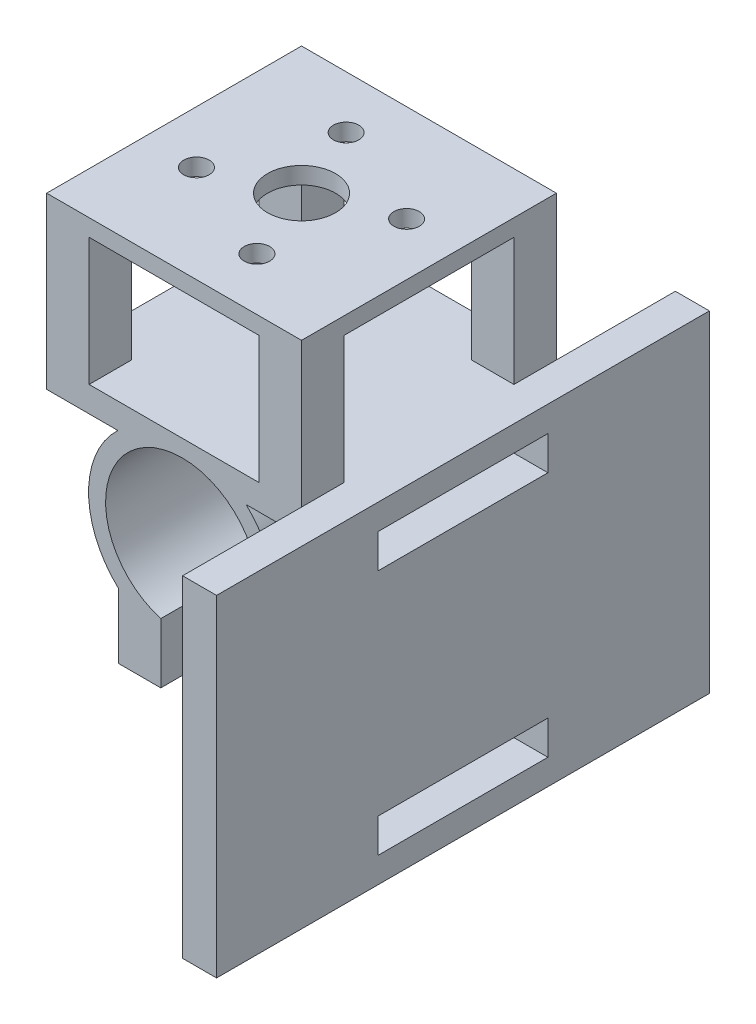
from build123d import *

# Parameters (mm, degrees)
SUPPORTOMOTORE_DEPTH     = 30
SCHIZZO2_W               = 58
SCHIZZO2_H               = 39
SUPPORTOESC_DEPTH        = 4
COLONNESUPPORTOESC_REACH = 62.166
SCHIZZO3_R               = 3
SCHIZZO7_W               = 5
SCHIZZO7_H               = 5
SUPPORTIBASEMOTORE_DEPTH = 15
SCHIZZO8_W               = 30
SCHIZZO8_H               = 30
BASEMOTORE_DEPTH         = 2
SCHIZZO9_R               = 1.5
SCHIZZO9_R_2             = 4
FORIAGGANCIOMOTORE_DEPTH = 2
SCHIZZO10_W              = 20
SCHIZZO10_H              = 4
APERTURAFASCETTA_DEPTH   = 4


with BuildPart() as part:
    # Schizzo1 → SupportoMotore (new body)
    with BuildSketch(Plane.XY):
        with BuildLine():
            Line((-2.5, -10.712142643), (-2.5, -15.712142643))
            Line((-2.5, -15.712142643), (-7.5, -15.712142643))
            Line((-7.5, -15.712142643), (-7.5, -8.04673847))
            ThreePointArc((-7.5, -8.04673847), (-10.999946955, -0.034161219), (-7.549834435, 8))
            Line((-7.549834435, 8), (-15.935446939, 8))
            Line((-15.935446939, 8), (-15.935446939, 11))
            Line((-15.935446939, 11), (14.064553061, 11))
            Line((14.064553061, 11), (14.064553061, 8))
            Line((14.064553061, 8), (7.549834435, 8))
            ThreePointArc((7.549834435, 8), (10.999946955, -0.034161219), (7.5, -8.04673847))
            Line((7.5, -8.04673847), (7.5, -15.712142643))
            Line((7.5, -15.712142643), (2.5, -15.712142643))
            Line((2.5, -15.712142643), (2.5, -10.712142643))
            Line((2.5, -10.712142643), (2.5, -8.645808233))
            ThreePointArc((2.5, -8.645808233), (0, 9), (-2.5, -8.645808233))
            Line((-2.5, -8.645808233), (-2.5, -10.712142643))
        make_face()
    extrude(amount=SUPPORTOMOTORE_DEPTH)

    # Schizzo2 → SupportoESC (add)
    with BuildSketch(Plane(origin=(14.064553061, 0, 0), x_dir=(0, 0, -1), z_dir=(1, 0, 0))):
        with Locations((-15, -8.5)):
            Rectangle(SCHIZZO2_W, SCHIZZO2_H)
    extrude(amount=SUPPORTOESC_DEPTH)

    # Schizzo3 → ColonneSupportoESC (add, up to next)
    with BuildSketch(Plane.ZY.offset(-14.064553061), mode=Mode.PRIVATE) as colonnesupportoesc_sk1:
        with Locations(Location((22, -6, 0), (0, 0, 223.019415965))):
            Circle(SCHIZZO3_R)
    colonnesupportoesc_tool1 = extrude(colonnesupportoesc_sk1.sketch, amount=COLONNESUPPORTOESC_REACH, mode=Mode.PRIVATE) - part.part
    # Schizzo3 → ColonneSupportoESC (add, up to next)
    with BuildSketch(Plane.ZY.offset(-14.064553061), mode=Mode.PRIVATE) as colonnesupportoesc_sk2:
        with Locations(Location((8, -6, 0), (0, 0, 223.019415965))):
            Circle(SCHIZZO3_R)
    colonnesupportoesc_tool2 = extrude(colonnesupportoesc_sk2.sketch, amount=COLONNESUPPORTOESC_REACH, mode=Mode.PRIVATE) - part.part
    add(colonnesupportoesc_tool1.solids().sort_by_distance((14.064553, -6, 22))[0])
    add(colonnesupportoesc_tool2.solids().sort_by_distance((14.064553, -6, 8))[0])

    # Schizzo7 → SupportiBaseMotore (add)
    with BuildSketch(Plane(origin=(0, 11, 0), x_dir=(1, 0, 0), z_dir=(0, 1, 0))):
        with Locations((-13.435446939, -27.5)):
            Rectangle(SCHIZZO7_W, SCHIZZO7_H)
        with Locations((11.564553061, -27.5)):
            Rectangle(SCHIZZO7_W, SCHIZZO7_H)
        with Locations((11.564553061, -2.5)):
            Rectangle(SCHIZZO7_W, SCHIZZO7_H)
        with Locations((-13.435446939, -2.5)):
            Rectangle(SCHIZZO7_W, SCHIZZO7_H)
    extrude(amount=SUPPORTIBASEMOTORE_DEPTH)

    # Schizzo8 → BaseMotore (add)
    with BuildSketch(Plane(origin=(0, 26, 0), x_dir=(1, 0, 0), z_dir=(0, 1, 0))):
        with Locations((-0.935446939, -15)):
            Rectangle(SCHIZZO8_W, SCHIZZO8_H)
    extrude(amount=BASEMOTORE_DEPTH)

    # Schizzo9 → ForiAggancioMotore (cut)
    with BuildSketch(Plane(origin=(0, 28, 0), x_dir=(1, 0, 0), z_dir=(0, 1, 0))):
        with Locations(Location((2.623315698, -23.808246618, 0), (0, 0, 270))):
            Circle(SCHIZZO9_R)
        with Locations(Location((-9.743693557, -18.558762637, 0), (0, 0, 270))):
            Circle(SCHIZZO9_R)
        with Locations(Location((-4.494209576, -6.191753382, 0), (0, 0, 270))):
            Circle(SCHIZZO9_R)
        with Locations(Location((7.872799679, -11.441237363, 0), (0, 0, 270))):
            Circle(SCHIZZO9_R)
        with Locations(Location((-0.935446939, -15, 0), (0, 0, 270))):
            Circle(SCHIZZO9_R_2)
    extrude(amount=-FORIAGGANCIOMOTORE_DEPTH, mode=Mode.SUBTRACT)

    # Schizzo10 → AperturaFascetta (cut)
    with BuildSketch(Plane(origin=(18.064553061, 0, 0), x_dir=(0, 0, -1), z_dir=(1, 0, 0))):
        with Locations((-15, 6)):
            Rectangle(SCHIZZO10_W, SCHIZZO10_H)
        with Locations((-15, -23)):
            Rectangle(SCHIZZO10_W, SCHIZZO10_H)
    extrude(amount=-APERTURAFASCETTA_DEPTH, mode=Mode.SUBTRACT)


solid = part.part
